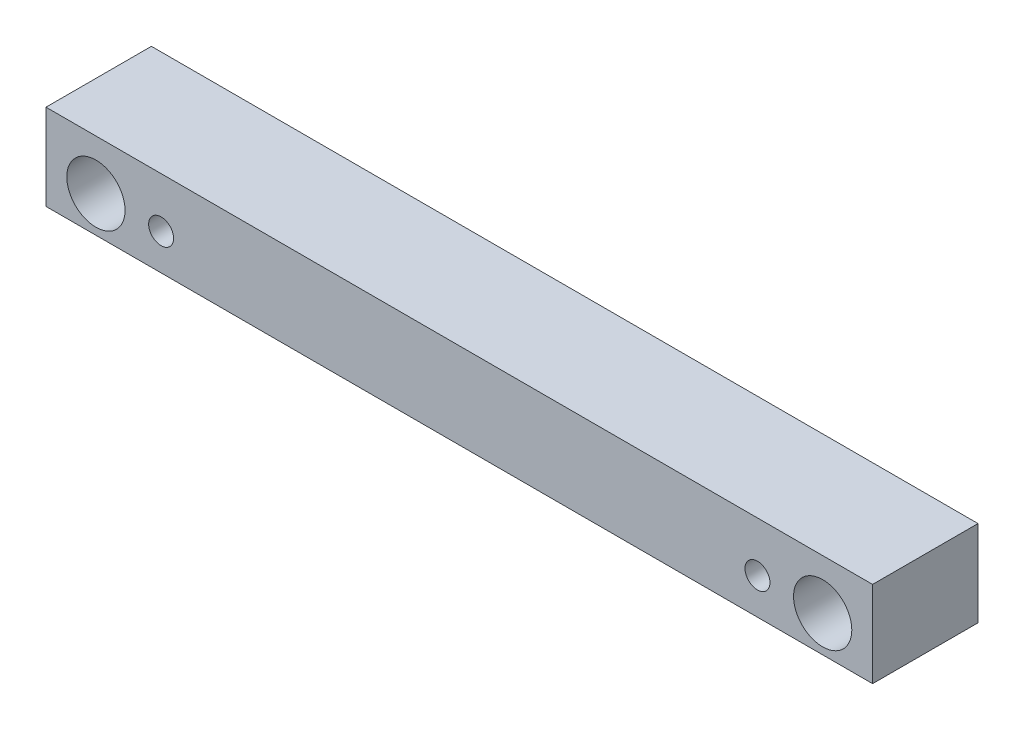
from build123d import *

# Parameters (mm, degrees)
SZKIC1_W                    = 596
SZKIC1_H                    = 62
DODANIE_WYCI_GNI_CIE1_DEPTH = 76
SZKIC2_R                    = 21
WYTNIJ_WYCI_GNI_CIE1_DEPTH  = 76
SZKIC3_R                    = 21
WYTNIJ_WYCI_GNI_CIE2_DEPTH  = 76
SZKIC4_W                    = 76
SZKIC4_H                    = 9
SZKIC5_W                    = 76
SZKIC5_H                    = 9


with BuildPart() as part:
    # Szkic1 → Dodanie-wyciągnięcie1 (new body)
    with BuildSketch(Plane.XY):
        with Locations((0, 167)):
            Rectangle(SZKIC1_W, SZKIC1_H)
    extrude(amount=DODANIE_WYCI_GNI_CIE1_DEPTH)

    # Szkic2 → Wytnij-wyciągnięcie1 (cut)
    with BuildSketch(Plane.XY.offset(76)):
        with Locations((262, 162)):
            Circle(SZKIC2_R)
    extrude(amount=-WYTNIJ_WYCI_GNI_CIE1_DEPTH, mode=Mode.SUBTRACT)

    # Szkic3 → Wytnij-wyciągnięcie2 (cut)
    with BuildSketch(Plane.XY.offset(76)):
        with Locations((-262, 162)):
            Circle(SZKIC3_R)
    extrude(amount=-WYTNIJ_WYCI_GNI_CIE2_DEPTH, mode=Mode.SUBTRACT)

    # Szkic4 → Wycięcie-obrót1 (revolve, cut)
    with BuildSketch(Plane(origin=(215, 0, 0), x_dir=(0, 0, -1), z_dir=(1, 0, 0))):
        with Locations((-38, 166.5)):
            Rectangle(SZKIC4_W, SZKIC4_H)
    revolve(axis=Axis((215, 162, 0), (0, 0, 1)), mode=Mode.SUBTRACT)

    # Szkic5 → Wycięcie-obrót2 (revolve, cut)
    with BuildSketch(Plane(origin=(-215, 0, 0), x_dir=(0, 0, -1), z_dir=(1, 0, 0))):
        with Locations((-38, 166.5)):
            Rectangle(SZKIC5_W, SZKIC5_H)
    revolve(axis=Axis((-215, 162, 0), (0, 0, 1)), mode=Mode.SUBTRACT)


solid = part.part
